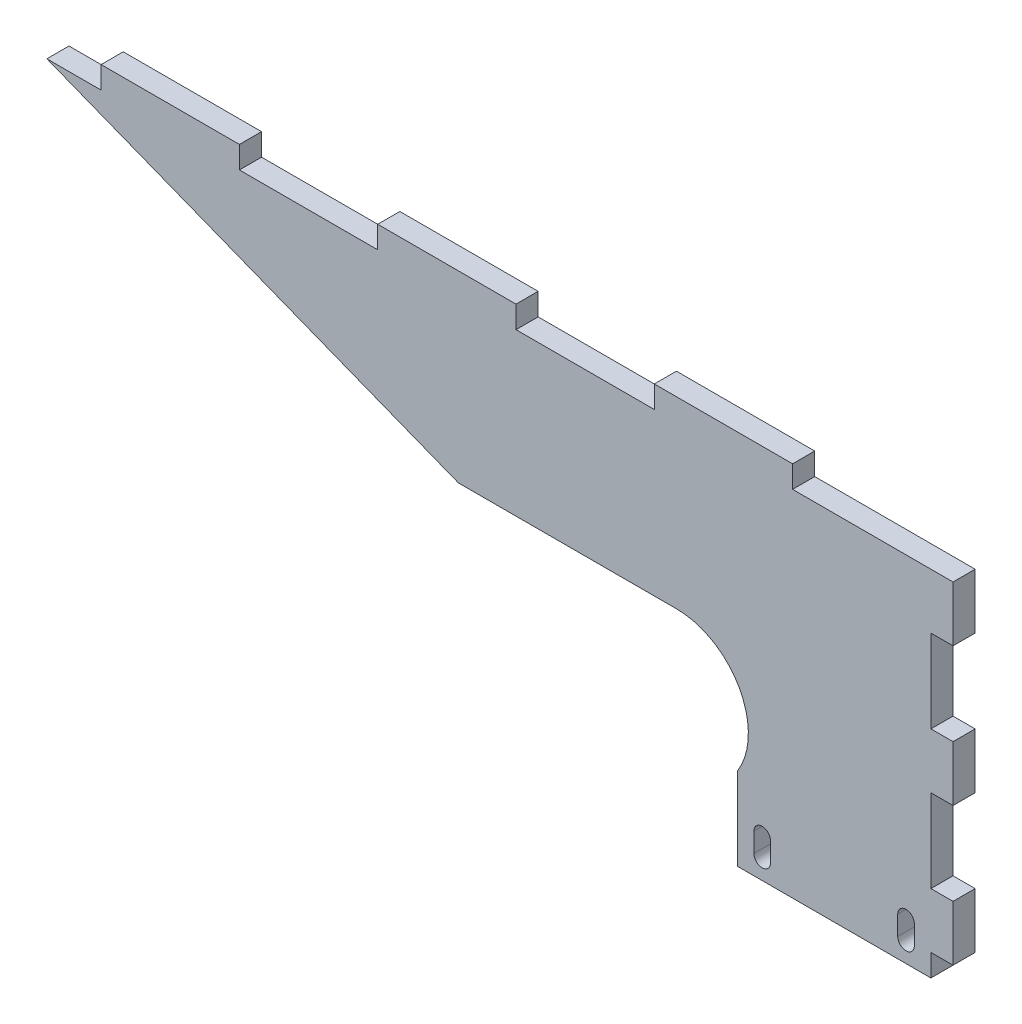
from build123d import *

# Parameters (mm, degrees)
BOSS_EXTRUDE1_DEPTH = 2
CUT_EXTRUDE1_REACH  = 186.662
SKETCH3_W           = 25
SKETCH3_H           = 4
CUT_EXTRUDE2_DEPTH  = 185.661853126
SKETCH4_W           = 4
SKETCH4_H           = 10
BOSS_EXTRUDE2_DEPTH = 4
CUT_EXTRUDE3_DEPTH  = 176.327288924


with BuildPart() as part:
    # Sketch1 → Boss-Extrude1 (new, symmetric)
    with BuildSketch(Plane.XY):
        Polygon((0, 4), (0, 72), (-170, 72), (-35, 19), (-35, 4), align=None)
    extrude(amount=BOSS_EXTRUDE1_DEPTH, both=True)

    # Sketch2 → Cut-Extrude1 (cut, up to next)
    with BuildSketch(Plane.XY.offset(2), mode=Mode.PRIVATE) as cut_extrude1_sk1:
        with BuildLine():
            Line((-3, 11), (-3, 7.5))
            ThreePointArc((-3, 7.5), (-4.5, 6), (-6, 7.5))
            Line((-6, 7.5), (-6, 11))
            ThreePointArc((-6, 11), (-4.5, 12.5), (-3, 11))
        make_face()
    cut_extrude1_tool1 = extrude(cut_extrude1_sk1.sketch, amount=-CUT_EXTRUDE1_REACH, mode=Mode.PRIVATE) & part.part
    # Sketch2 → Cut-Extrude1 (cut, up to next)
    with BuildSketch(Plane.XY.offset(2), mode=Mode.PRIVATE) as cut_extrude1_sk2:
        with BuildLine():
            Line((-32, 11), (-32, 7.5))
            ThreePointArc((-32, 7.5), (-30.5, 6), (-29, 7.5))
            Line((-29, 7.5), (-29, 11))
            ThreePointArc((-29, 11), (-30.5, 12.5), (-32, 11))
        make_face()
    cut_extrude1_tool2 = extrude(cut_extrude1_sk2.sketch, amount=-CUT_EXTRUDE1_REACH, mode=Mode.PRIVATE) & part.part
    add(cut_extrude1_tool1.solids().sort_by_distance((-4.5, 9.25, 2))[0], mode=Mode.SUBTRACT)
    add(cut_extrude1_tool2.solids().sort_by_distance((-30.5, 9.25, 2))[0], mode=Mode.SUBTRACT)

    # Sketch3 → Cut-Extrude2 (cut, through all)
    with BuildSketch(Plane.XY.offset(2)):
        with Locations((-62.5, 70)):
            Rectangle(SKETCH3_W, SKETCH3_H)
        with Locations((-12.5, 70)):
            Rectangle(SKETCH3_W, SKETCH3_H)
        with Locations((-112.5, 70)):
            Rectangle(SKETCH3_W, SKETCH3_H)
        with Locations((-162.5, 70)):
            Rectangle(SKETCH3_W, SKETCH3_H)
        with Locations((-212.5, 70)):
            Rectangle(SKETCH3_W, SKETCH3_H)
        with Locations((-262.5, 70)):
            Rectangle(SKETCH3_W, SKETCH3_H)
        with Locations((-312.5, 70)):
            Rectangle(SKETCH3_W, SKETCH3_H)
        with Locations((-362.5, 70)):
            Rectangle(SKETCH3_W, SKETCH3_H)
        with Locations((-412.5, 70)):
            Rectangle(SKETCH3_W, SKETCH3_H)
        with Locations((-462.5, 70)):
            Rectangle(SKETCH3_W, SKETCH3_H)
    extrude(amount=-CUT_EXTRUDE2_DEPTH, mode=Mode.SUBTRACT)

    # Sketch4 → Boss-Extrude2 (add)
    with BuildSketch(Plane(origin=(0, 0, 0), x_dir=(0, 0, -1), z_dir=(1, 0, 0))):
        with Locations((0, 63)):
            Rectangle(SKETCH4_W, SKETCH4_H)
        with Locations((0, 38)):
            Rectangle(SKETCH4_W, SKETCH4_H)
        with Locations((0, 13)):
            Rectangle(SKETCH4_W, SKETCH4_H)
    extrude(amount=BOSS_EXTRUDE2_DEPTH)

    # Sketch5 → Cut-Extrude3 (cut, through all)
    with BuildSketch(Plane.XY.offset(2)):
        with BuildLine():
            Line((-85.433962264, 38.8), (-46, 38.8))
            ThreePointArc((-46, 38.8), (-33, 25.8), (-46, 12.8))
            Line((-46, 12.8), (-85.433962264, 12.8))
            ThreePointArc((-85.433962264, 12.8), (-98.433962264, 25.8), (-85.433962264, 38.8))
        make_face()
    extrude(amount=-CUT_EXTRUDE3_DEPTH, mode=Mode.SUBTRACT)


solid = part.part
